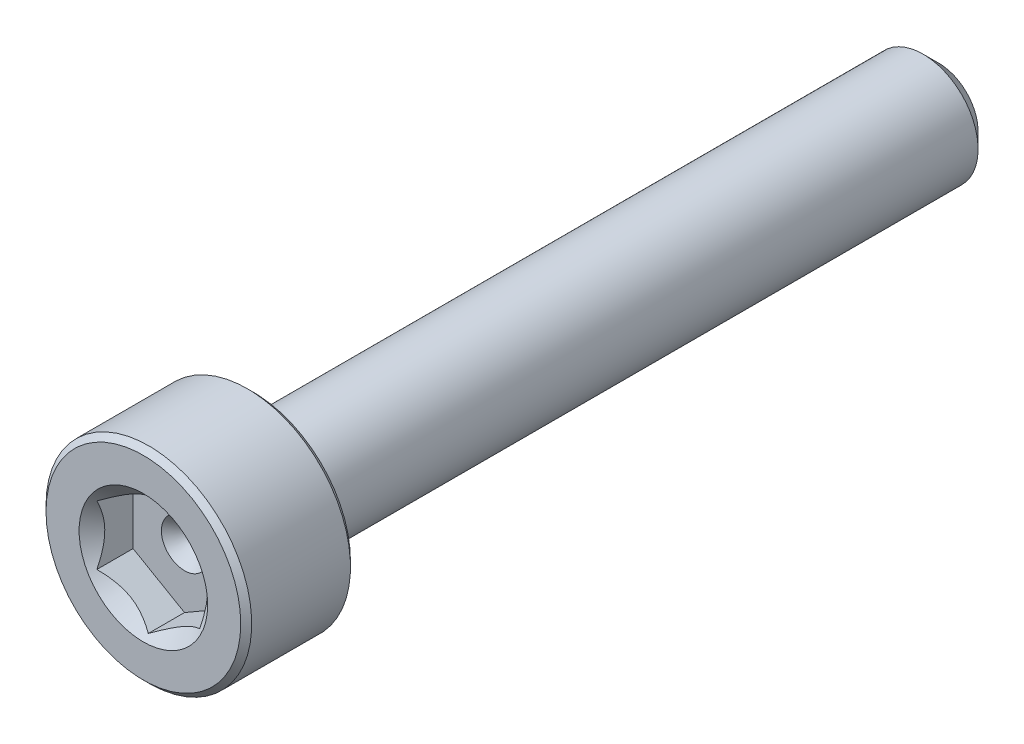
from build123d import *

# Parameters (mm, degrees)
CUT_EXTRUDE1_DEPTH = 0.6
SKETCH4_R          = 0.9375
CUT_EXTRUDE2_DEPTH = 0.8
CUT_EXTRUDE2_DRAFT = -45


with BuildPart() as part:
    # Sketch2 → Revolve1 (revolve)
    with BuildSketch(Plane(origin=(0, 0, 0), x_dir=(0, 0, -1), z_dir=(1, 0, 0)), mode=Mode.PRIVATE) as revolve1_sk:
        with BuildLine():
            Line((-5.8, 0), (-5.8, 1.42))
            Line((-5.8, 1.42), (-5.72, 1.5))
            Line((-5.72, 1.5), (-4.28, 1.5))
            Line((-4.28, 1.5), (-4.2, 1.42))
            Line((-4.2, 1.42), (-4.2, 1))
            ThreePointArc((-4.2, 1), (-4.141421356, 0.858578644), (-4, 0.8))
            Line((-4, 0.8), (5.572668332, 0.8))
            Line((5.572668332, 0.8), (5.8, 0.572668332))
            Line((5.8, 0.572668332), (5.8, 0))
            Line((5.8, 0), (-5.8, 0))
        make_face()
    revolve(revolve1_sk.sketch.rotate(Axis((0, 0, -5.8), (0, 0, 1)), 90), axis=Axis((0, 0, -5.8), (0, 0, 1)))

    # Sketch3 → Cut-Extrude1 (cut)
    with BuildSketch(Plane.XY.offset(5.8)):
        Polygon((0.75, -0.433012702), (0.75, 0.433012702), (0, 0.866025404), (-0.75, 0.433012702), (-0.75, -0.433012702), (0, -0.866025404), align=None)
    extrude(amount=-CUT_EXTRUDE1_DEPTH, mode=Mode.SUBTRACT)


with BuildPart() as cut_extrude2_tool:
    # Sketch4 → Cut-Extrude2 (with draft: the straight prism first)
    with BuildSketch(Plane.XY.offset(5.8)):
        Circle(SKETCH4_R)
    extrude(amount=-CUT_EXTRUDE2_DEPTH)
    # Cut-Extrude2: the draft: its side faces are tilted about the plane it starts from
    cut_extrude2_sides = [cut_extrude2_tool.faces().sort_by_distance(p)[0] for p in [
        (-0.9375, 0, 5.4),
    ]]
    draft(cut_extrude2_sides, Plane.XY.offset(5.8), CUT_EXTRUDE2_DRAFT)


with BuildPart() as part_1:
    add(part.part)

    # Cut-Extrude2: cut by cut_extrude2_tool
    add(cut_extrude2_tool.part, mode=Mode.SUBTRACT)


solid = part_1.part
